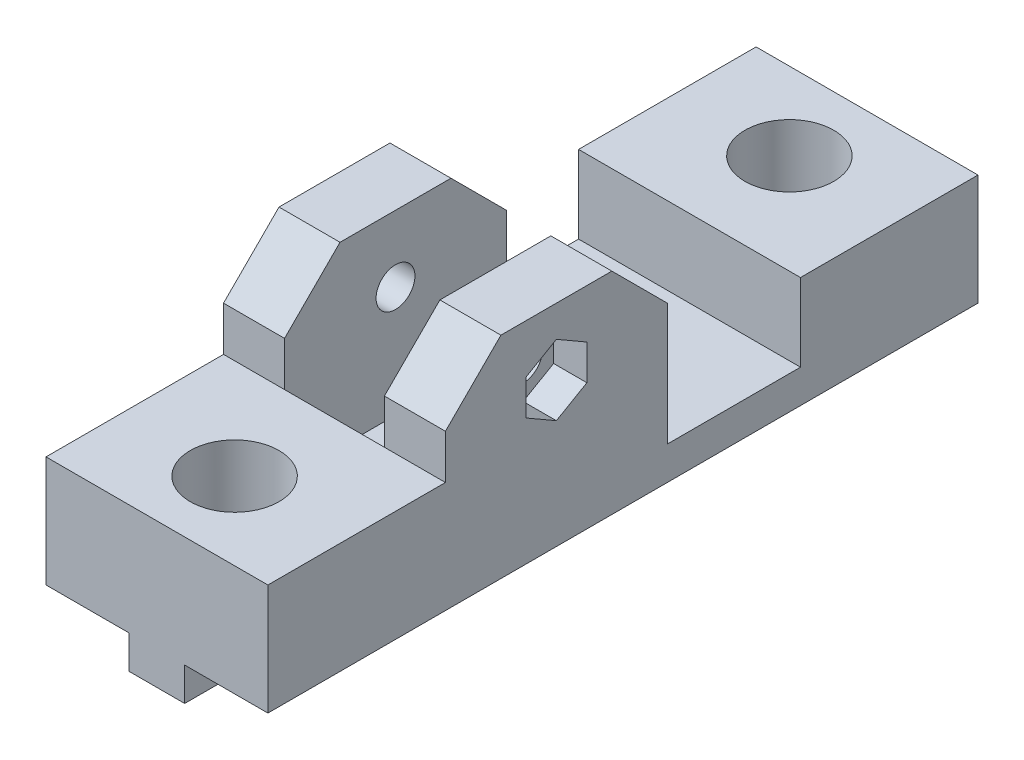
from build123d import *

# Parameters (mm, degrees)
SKETCH1_W               = 20
SKETCH1_H               = 30
BOSS_EXTRUDE1_DEPTH     = 3
SKETCH2_W               = 5
SKETCH2_H               = 12
BOSS_EXTRUDE2_DEPTH     = 3
SKETCH3_R               = 7
SKETCH3_R_2             = 4
BOSS_EXTRUDE3_DEPTH     = 7
SKETCH4_R               = 4
BOSS_EXTRUDE4_DEPTH     = 1
CUT_EXTRUDE1_DEPTH      = 20.339079606
CUT_EXTRUDE1_DEPTH_BACK = 20.339079606
SKETCH5_R               = 3
SKETCH6_R               = 7
SKETCH6_R_2             = 4
BOSS_EXTRUDE6_DEPTH     = 7
SKETCH7_W               = 20
SKETCH7_H               = 3
BOSS_EXTRUDE7_DEPTH     = 19
SKETCH8_W               = 5
SKETCH8_H               = 3
BOSS_EXTRUDE8_DEPTH     = 12
SKETCH10_W              = 5.5
SKETCH10_H              = 20
BOSS_EXTRUDE9_DEPTH     = 16
CUT_EXTRUDE2_DEPTH      = 57.231663678
CUT_EXTRUDE2_DEPTH_BACK = 57.231663678
SKETCH11_R              = 1.75
SKETCH12_R              = 3
SKETCH12_R_2            = 1.75
CUT_EXTRUDE3_DEPTH      = 3
CUT_EXTRUDE4_START      = -3
SKETCH13_R              = 1.75
CUT_EXTRUDE4_DEPTH      = 3
CHAMFER2_SIZE           = 5
CUT_EXTRUDE5_START      = -1.5
SKETCH14_R              = 4
CUT_EXTRUDE5_DEPTH      = 1.5


with BuildPart() as part:
    # Sketch1 → Boss-Extrude1 (new body)
    with BuildSketch(Plane(origin=(0, 0, 0), x_dir=(1, 0, 0), z_dir=(0, 1, 0))):
        Rectangle(SKETCH1_W, SKETCH1_H)
    boss_extrude1 = extrude(amount=BOSS_EXTRUDE1_DEPTH)

    # Sketch2 → Boss-Extrude2 (add)
    with BuildSketch(Plane.XZ):
        with Locations((0, -9)):
            Rectangle(SKETCH2_W, SKETCH2_H)
    boss_extrude2 = extrude(amount=BOSS_EXTRUDE2_DEPTH)

    # Sketch3 → Boss-Extrude3 (add)
    with BuildSketch(Plane(origin=(0, 3, 0), x_dir=(1, 0, 0), z_dir=(0, 1, 0))):
        with Locations(Location((0, 8, 0), (0, 0, 90))):
            Circle(SKETCH3_R)
        with Locations(Location((0, 8, 0), (0, 0, 270))):
            Circle(SKETCH3_R_2, mode=Mode.SUBTRACT)
    boss_extrude3 = extrude(amount=BOSS_EXTRUDE3_DEPTH)

    # Sketch4 → Boss-Extrude4 (add)
    with BuildSketch(Plane(origin=(0, 3, 0), x_dir=(1, 0, 0), z_dir=(0, 1, 0))):
        with Locations(Location((0, 8, 0), (0, 0, 270))):
            Circle(SKETCH4_R)
    boss_extrude4 = extrude(amount=BOSS_EXTRUDE4_DEPTH)

    # Sketch5 → Cut-Extrude1 (cut, two sides: drawn at the far end of the back side and taken through both)
    with BuildSketch(Plane(origin=(0, 3, 0), x_dir=(1, 0, 0), z_dir=(0, 1, 0)).offset(-CUT_EXTRUDE1_DEPTH_BACK)):
        with Locations(Location((0, -8.5, 0), (0, 0, 90))):
            Circle(SKETCH5_R)
    extrude(amount=CUT_EXTRUDE1_DEPTH + CUT_EXTRUDE1_DEPTH_BACK, mode=Mode.SUBTRACT)

    # Sketch6 → Boss-Extrude6 (add)
    # profile 1 of 2: a face of its own
    with BuildSketch(Plane(origin=(0, 3, 0), x_dir=(1, 0, 0), z_dir=(0, 1, 0))):
        Polygon((0, 15), (-10, 15), (-10, -1), (10, -1), (10, 15), align=None)
        with BuildLine():
            ThreePointArc((7, 8), (-4.949747468, 3.050252532), (0, 15))
            ThreePointArc((0, 15), (4.949747468, 12.949747468), (7, 8))
        make_face(mode=Mode.SUBTRACT)
    # profile 2 of 2: a face of its own
    with BuildSketch(Plane(origin=(0, 3, 0), x_dir=(1, 0, 0), z_dir=(0, 1, 0))):
        with Locations((0, 8)):
            Circle(SKETCH6_R)
        with Locations(Location((0, 8, 0), (0, 0, 270))):
            Circle(SKETCH6_R_2, mode=Mode.SUBTRACT)
    boss_extrude6 = extrude(amount=BOSS_EXTRUDE6_DEPTH)

    # Sketch7 → Boss-Extrude7 (add)
    with BuildSketch(Plane.XY.offset(15)):
        with Locations((0, 1.5)):
            Rectangle(SKETCH7_W, SKETCH7_H)
    extrude(amount=BOSS_EXTRUDE7_DEPTH)

    # Mirror3: Boss-Extrude1, Boss-Extrude2, Boss-Extrude3, Boss-Extrude4, Boss-Extrude6 across plane
    add(boss_extrude1.mirror(Plane.XY.offset(17)))
    add(boss_extrude2.mirror(Plane.XY.offset(17)))
    add(boss_extrude3.mirror(Plane.XY.offset(17)))
    add(boss_extrude4.mirror(Plane.XY.offset(17)))
    add(boss_extrude6.mirror(Plane.XY.offset(17)))

    # Sketch8 → Boss-Extrude8 (add)
    with BuildSketch(Plane(origin=(0, 0, 37), x_dir=(-1, 0, 0), z_dir=(0, 0, -1))):
        with Locations((0, -1.5)):
            Rectangle(SKETCH8_W, SKETCH8_H)
    extrude(amount=BOSS_EXTRUDE8_DEPTH)

    # Sketch10 → Boss-Extrude9 (add)
    with BuildSketch(Plane(origin=(0, 3, 0), x_dir=(1, 0, 0), z_dir=(0, 1, 0))):
        with Locations((-7.25, -23)):
            Rectangle(SKETCH10_W, SKETCH10_H)
        with Locations((7.25, -23)):
            Rectangle(SKETCH10_W, SKETCH10_H)
    extrude(amount=BOSS_EXTRUDE9_DEPTH)

    # Sketch11 → Cut-Extrude2 (cut, two sides: drawn at the far end of the back side and taken through both)
    with BuildSketch(Plane.ZY.offset(10).offset(-CUT_EXTRUDE2_DEPTH_BACK)):
        with Locations((23, 13)):
            Circle(SKETCH11_R)
    extrude(amount=CUT_EXTRUDE2_DEPTH + CUT_EXTRUDE2_DEPTH_BACK, mode=Mode.SUBTRACT)

    # Sketch12 → Cut-Extrude3 (cut)
    with BuildSketch(Plane.ZY.offset(10)):
        with Locations((23, 13)):
            Circle(SKETCH12_R)
        with Locations((23, 13)):
            Circle(SKETCH12_R_2, mode=Mode.SUBTRACT)
    extrude(amount=-CUT_EXTRUDE3_DEPTH, mode=Mode.SUBTRACT)

    # Sketch13 → Cut-Extrude4 (cut)
    with BuildSketch(Plane(origin=(10, 0, 0), x_dir=(0, 0, -1), z_dir=(1, 0, 0)).offset(CUT_EXTRUDE4_START)):
        Polygon((-23, 16.175426481), (-25.75, 14.58771324), (-25.75, 11.41228676), (-23, 9.824573519), (-20.25, 11.41228676), (-20.25, 14.58771324), align=None)
        with Locations((-23, 13)):
            Circle(SKETCH13_R, mode=Mode.SUBTRACT)
    extrude(amount=CUT_EXTRUDE4_DEPTH, mode=Mode.SUBTRACT)

    # Chamfer2
    chamfer2_edges = [part.edges().sort_by_distance(p)[0] for p in [
        (-7.25, 19, 13),
        (-7.25, 19, 33),
        (7.25, 19, 13),
        (7.25, 19, 33),
    ]]
    chamfer(chamfer2_edges, length=CHAMFER2_SIZE)

    # Sketch14 → Cut-Extrude5 (cut)
    with BuildSketch(Plane(origin=(0, 4, 0), x_dir=(1, 0, 0), z_dir=(0, 1, 0)).offset(CUT_EXTRUDE5_START)):
        with Locations(Location((0, -42, 0), (0, 0, 90))):
            Circle(SKETCH14_R)
        with Locations(Location((0, 8, 0), (0, 0, 270))):
            Circle(SKETCH14_R)
    extrude(amount=CUT_EXTRUDE5_DEPTH, mode=Mode.SUBTRACT)


solid = part.part
